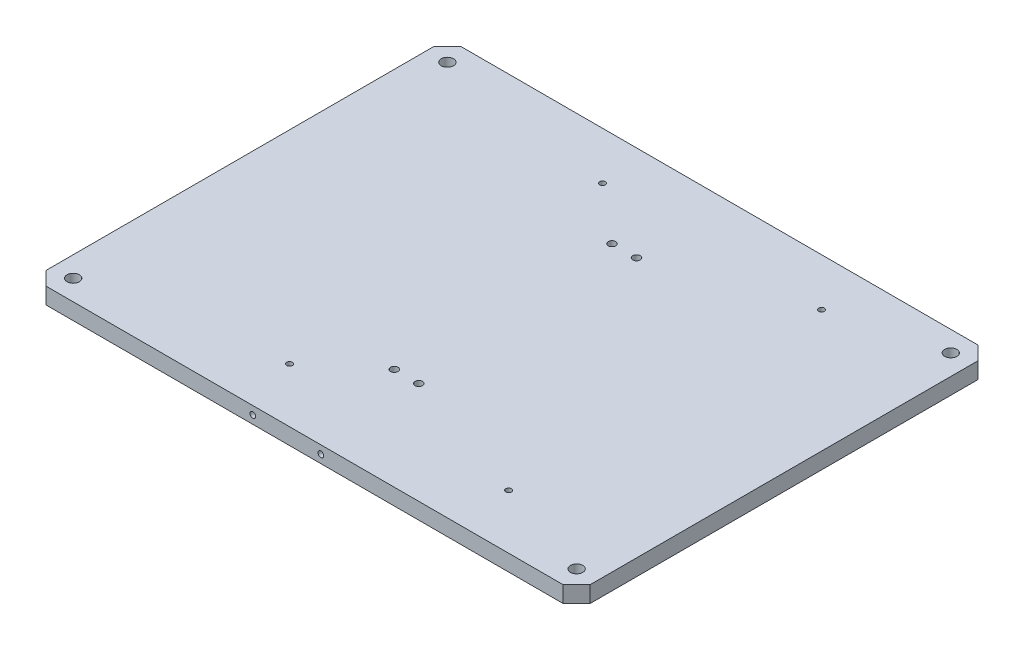
from build123d import *

# Parameters (mm, degrees)
SKETCH1_W                                       = 400
SKETCH1_H                                       = 305
BOSS_EXTRUDE1_DEPTH                             = 12
CBORE_FOR_M5_SOCKET_HEAD_CAP_SCREW1_D           = 5.5
CBORE_FOR_M5_SOCKET_HEAD_CAP_SCREW1_CBORE_D     = 10
CBORE_FOR_M5_SOCKET_HEAD_CAP_SCREW1_CBORE_DEPTH = 5
M5X0_8_TAPPED_HOLE1_D                           = 4.2
M5X0_8_TAPPED_HOLE1_DEPTH                       = 14
M5X0_8_TAPPED_HOLE1_TIP                         = 1.2618073
CHAMFER1_SIZE                                   = 10
M8_CLEARANCE_HOLE1_D                            = 9
M5X0_8_TAPPED_HOLE2_D                           = 4.2


with BuildPart() as part:
    # Sketch1 → Boss-Extrude1 (new body)
    with BuildSketch(Plane(origin=(0, 0, 0), x_dir=(1, 0, 0), z_dir=(0, 1, 0))):
        with Locations((0, -152.5)):
            Rectangle(SKETCH1_W, SKETCH1_H)
    extrude(amount=BOSS_EXTRUDE1_DEPTH)

    # CBORE for M5 Socket Head Cap Screw1 (through all)
    with Locations(Plane.XZ):
        with Locations((-9, 230), (-9, 70), (9, 70), (9, 230)):
            CounterBoreHole(CBORE_FOR_M5_SOCKET_HEAD_CAP_SCREW1_D / 2, CBORE_FOR_M5_SOCKET_HEAD_CAP_SCREW1_CBORE_D / 2, CBORE_FOR_M5_SOCKET_HEAD_CAP_SCREW1_CBORE_DEPTH)

    # M5x0.8 Tapped Hole1
    with Locations(Plane.XY.offset(305)):
        with Locations((-38, 6), (12, 6)):
            Hole(M5X0_8_TAPPED_HOLE1_D / 2, depth=M5X0_8_TAPPED_HOLE1_DEPTH)
            with Locations((0, 0, -(M5X0_8_TAPPED_HOLE1_DEPTH + M5X0_8_TAPPED_HOLE1_TIP / 2))):  # 118° drill point
                Cone(0, M5X0_8_TAPPED_HOLE1_D / 2, M5X0_8_TAPPED_HOLE1_TIP, mode=Mode.SUBTRACT)

    # Chamfer1
    chamfer1_edges = [part.edges().sort_by_distance(p)[0] for p in [
        (-200, 6, 0),
        (200, 6, 0),
        (200, 6, 305),
        (-200, 6, 305),
    ]]
    chamfer(chamfer1_edges, length=CHAMFER1_SIZE)

    # M8 Clearance Hole1 (through all)
    with Locations(Plane(origin=(0, 12, 0), x_dir=(-1, 0, 0), z_dir=(0, 1, 0))):
        with Locations((185, 290), (185, 15), (-185, 15), (-185, 290)):
            Hole(M8_CLEARANCE_HOLE1_D / 2)

    # M5x0.8 Tapped Hole2 (through all)
    with Locations(Plane(origin=(0, 12, 0), x_dir=(-1, 0, 0), z_dir=(0, 1, 0))):
        with Locations((51, 265), (51, 35), (-110, 265), (-110, 35)):
            Hole(M5X0_8_TAPPED_HOLE2_D / 2)


solid = part.part
